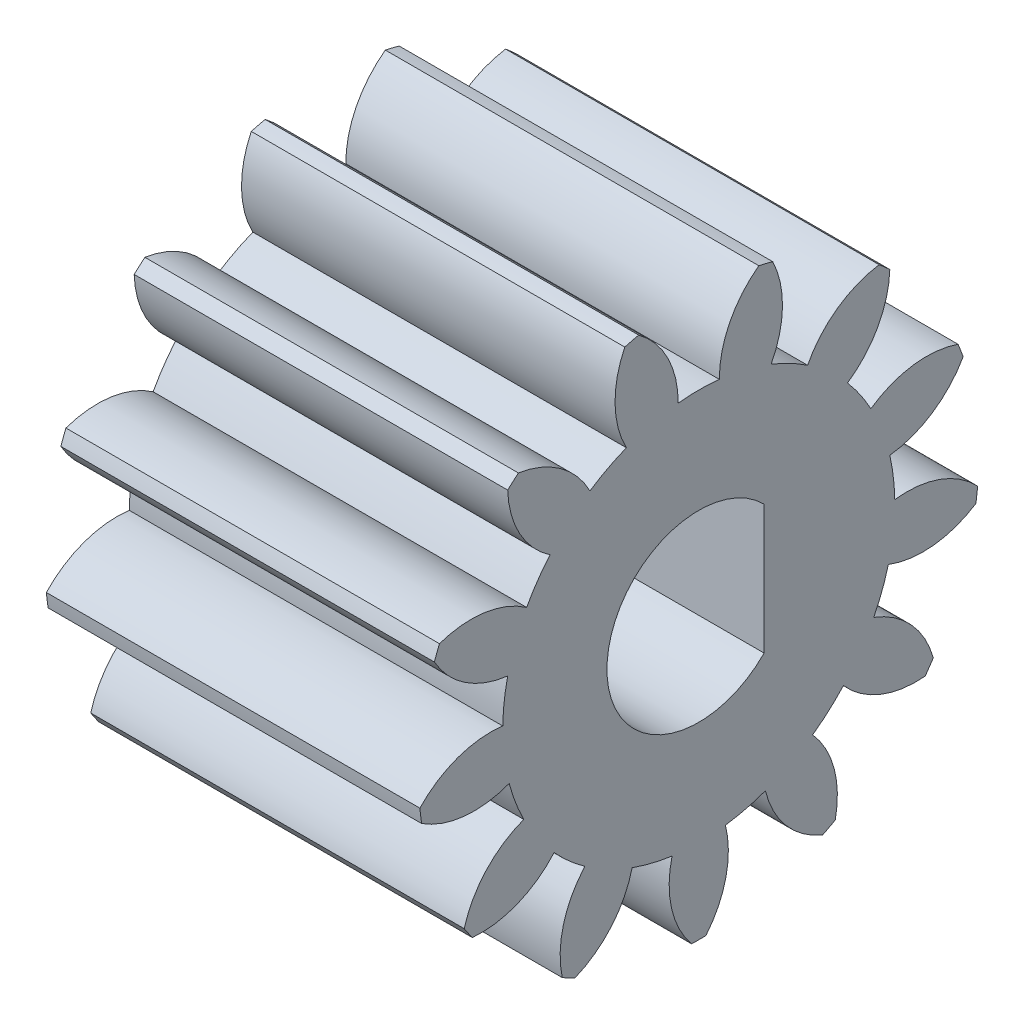
from build123d import *

# Parameters (mm, degrees)
BASPROSKE_W        = 6
BASPROSKE_H        = 4.5
TOOTHCUT_DEPTH     = 9.746427842
TEETHCUTS_COUNT    = 13
CUT_EXTRUDE1_REACH = 10.736


with BuildPart() as part:
    # BasProSke → Base-Revolve (revolve)
    with BuildSketch(Plane(origin=(0, 0, 0), x_dir=(1, 0, 0), z_dir=(0, 1, 0)), mode=Mode.PRIVATE) as base_revolve_sk:
        with Locations((3, 2.25)):
            Rectangle(BASPROSKE_W, BASPROSKE_H)
    revolve(base_revolve_sk.sketch.rotate(Axis((-10, 0, 0), (1, 0, 0)), 180), axis=Axis((-10, 0, 0), (1, 0, 0)))

    # TooCutSke → ToothCut (cut, through all)
    with BuildSketch(Plane(origin=(0, 0, 0), x_dir=(0, 0, -1), z_dir=(1, 0, 0))):
        with BuildLine():
            ThreePointArc((0.330578579, 3.131600039), (0, 3.149), (-0.330578579, 3.131600039))
            ThreePointArc((-0.330578579, 3.131600039), (-0.504119116, 3.854627805), (-0.992642471, 4.415190379))
            ThreePointArc((-0.992642471, 4.415190379), (0, 4.5254), (0.992642471, 4.415190379))
            ThreePointArc((0.992642471, 4.415190379), (0.504119116, 3.854627805), (0.330578579, 3.131600039))
        make_face()
    toothcut = extrude(amount=TOOTHCUT_DEPTH, mode=Mode.SUBTRACT)

    # TeethCuts: ToothCut ×13 about axis
    teethcuts_axis = Axis((0, 0, 0), (1, 0, 0))
    for i in range(1, TEETHCUTS_COUNT):
        add(toothcut.rotate(teethcuts_axis, i * 360 / TEETHCUTS_COUNT), mode=Mode.SUBTRACT)

    # Sketch1 → Cut-Extrude1 (cut, up to next)
    with BuildSketch(Plane.ZY, mode=Mode.PRIVATE) as cut_extrude1_sk1:
        with BuildLine():
            Line((-1.05, 1.035917468), (-1.05, -1.035917468))
            ThreePointArc((-1.05, -1.035917468), (1.475, 0), (-1.05, 1.035917468))
        make_face()
    cut_extrude1_tool1 = extrude(cut_extrude1_sk1.sketch, amount=-CUT_EXTRUDE1_REACH, mode=Mode.PRIVATE) & part.part
    add(cut_extrude1_tool1.solids().sort_by_distance((0, 0, 0.118985))[0], mode=Mode.SUBTRACT)


solid = part.part
